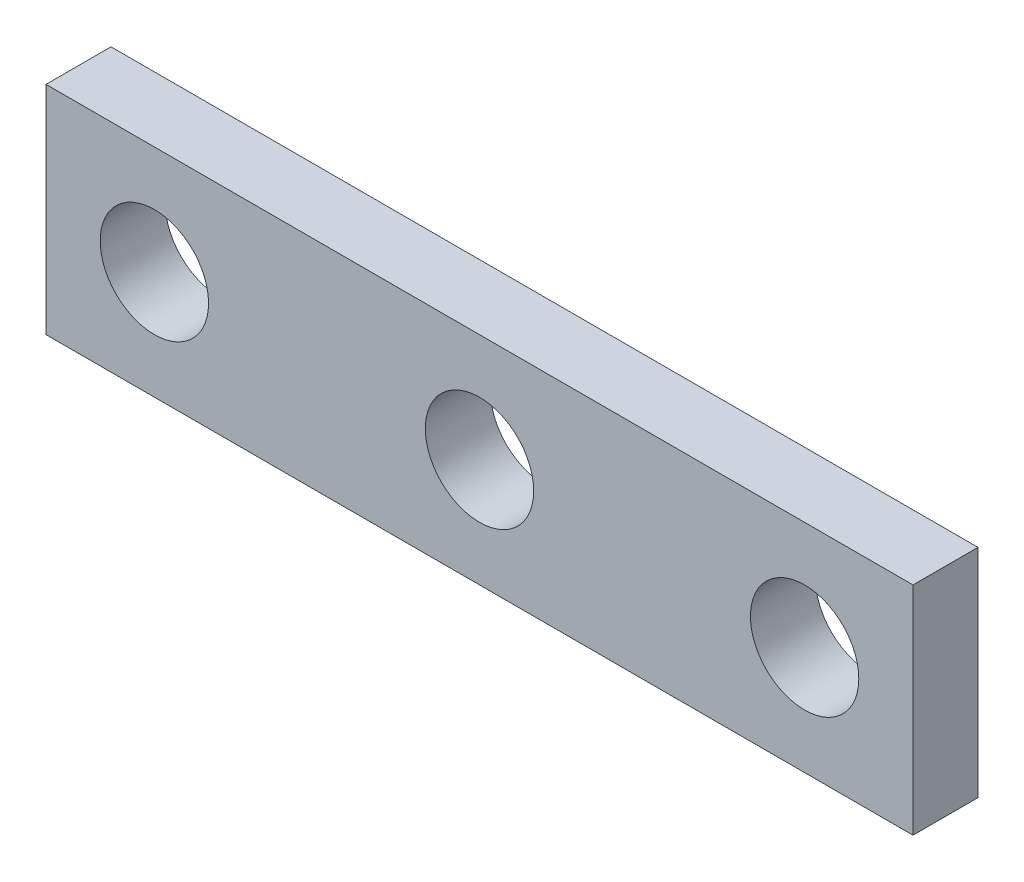
from build123d import *

# Parameters (mm, degrees)
SKETCH_1_W      = 40
SKETCH_1_H      = 10
SKETCH_1_R      = 2.5
EXTRUDE_1_DEPTH = 3


with BuildPart() as part:
    # 草圖1 → 填料-伸長1 (new body)
    with BuildSketch(Plane.XY):
        Rectangle(SKETCH_1_W, SKETCH_1_H)
        with Locations((-15, 0)):
            Circle(SKETCH_1_R, mode=Mode.SUBTRACT)
        with Locations((15, 0)):
            Circle(SKETCH_1_R, mode=Mode.SUBTRACT)
        Circle(SKETCH_1_R, mode=Mode.SUBTRACT)
    extrude(amount=EXTRUDE_1_DEPTH)


solid = part.part
